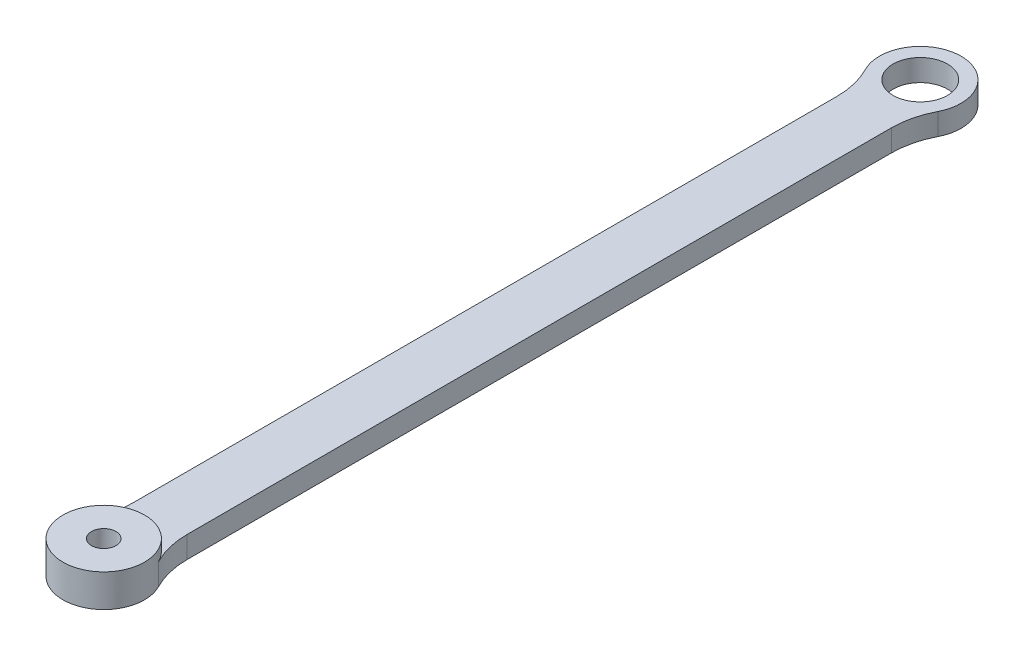
from build123d import *

# Parameters (mm, degrees)
SKETCH1_R           = 2.25
SKETCH1_R_2         = 5
BOSS_EXTRUDE1_DEPTH = 4
FILLET1_R           = 15
SKETCH2_R           = 7.5
SKETCH2_R_2         = 2.25
BOSS_EXTRUDE2_DEPTH = 2


with BuildPart() as part:
    # Sketch1 → Boss-Extrude1 (new body)
    with BuildSketch(Plane(origin=(0, 0, 0), x_dir=(1, 0, 0), z_dir=(0, 1, 0))):
        with BuildLine():
            ThreePointArc((-5, -69.409830056), (0, -82.5), (5, -69.409830056))
            Line((5, -69.409830056), (5, 69.409830056))
            ThreePointArc((5, 69.409830056), (0, 82.5), (-5, 69.409830056))
            Line((-5, 69.409830056), (-5, -69.409830056))
        make_face()
        with Locations(Location((0, -75, 0), (0, 0, 270))):
            Circle(SKETCH1_R, mode=Mode.SUBTRACT)
        with Locations(Location((0, 75, 0), (0, 0, 270))):
            Circle(SKETCH1_R_2, mode=Mode.SUBTRACT)
    extrude(amount=BOSS_EXTRUDE1_DEPTH)

    # Fillet1
    fillet1_edges = [part.edges().sort_by_distance(p)[0] for p in [
        (-5, 2, 69.409830056),
        (-5, 2, -69.409830056),
        (5, 2, -69.409830056),
        (5, 2, 69.409830056),
    ]]
    fillet(fillet1_edges, radius=FILLET1_R)

    # Sketch2 → Boss-Extrude2 (add)
    with BuildSketch(Plane(origin=(0, 4, 0), x_dir=(1, 0, 0), z_dir=(0, 1, 0))):
        with Locations(Location((0, -75, 0), (0, 0, 27.266044451))):
            Circle(SKETCH2_R)
        with Locations(Location((0, -75, 0), (0, 0, 270))):
            Circle(SKETCH2_R_2, mode=Mode.SUBTRACT)
    extrude(amount=BOSS_EXTRUDE2_DEPTH)


solid = part.part
